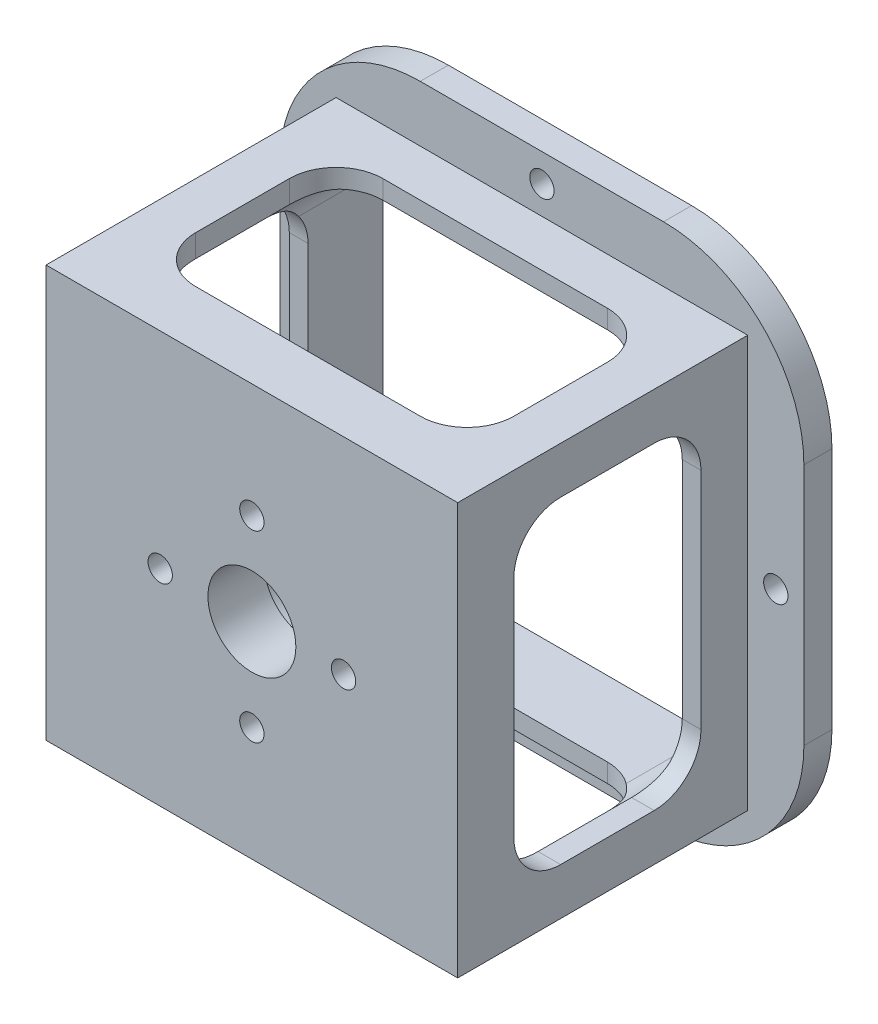
from build123d import *

# Parameters (mm, degrees)
SKETCH1_W           = 71.12
SKETCH1_H           = 71.12
BOSS_EXTRUDE1_DEPTH = 43.18
SKETCH2_W           = 71.12
SKETCH2_H           = 71.12
SKETCH2_W_2         = 55.88
SKETCH2_H_2         = 55.88
CUT_EXTRUDE1_DEPTH  = 39.37
SKETCH4_W           = 50.8
SKETCH4_H           = 50.8
CUT_EXTRUDE2_DEPTH  = 35.56
CUT_EXTRUDE3_REACH  = 111.456
SKETCH5_R           = 1.651
SKETCH5_R_2         = 5.969
CUT_EXTRUDE4_REACH  = 111.456
SKETCH6_R           = 1.651
FILLET1_R           = 6.35
CUT_EXTRUDE5_REACH  = 106.665
CIRPATTERN1_COUNT   = 4
FILLET3_R           = 19.05
SKETCH8_R           = 3.175
CUT_EXTRUDE6_DEPTH  = 3.81


with BuildPart() as part:
    # Sketch1 → Boss-Extrude1 (new body)
    with BuildSketch(Plane.XY):
        with Locations((35.56, 35.56)):
            Rectangle(SKETCH1_W, SKETCH1_H)
    extrude(amount=BOSS_EXTRUDE1_DEPTH)

    # Sketch2 → Cut-Extrude1 (cut)
    with BuildSketch(Plane.XY.offset(43.18)):
        with Locations((35.56, 35.56)):
            Rectangle(SKETCH2_W, SKETCH2_H)
        with Locations((35.56, 35.56)):
            Rectangle(SKETCH2_W_2, SKETCH2_H_2, mode=Mode.SUBTRACT)
    extrude(amount=-CUT_EXTRUDE1_DEPTH, mode=Mode.SUBTRACT)

    # Sketch4 → Cut-Extrude2 (cut)
    with BuildSketch(Plane(origin=(0, 0, 0), x_dir=(-1, 0, 0), z_dir=(0, 0, -1))):
        with Locations((-35.56, 35.56)):
            Rectangle(SKETCH4_W, SKETCH4_H)
    extrude(amount=-CUT_EXTRUDE2_DEPTH, mode=Mode.SUBTRACT)

    # Sketch5 → Cut-Extrude3 (cut, up to next)
    with BuildSketch(Plane.XY.offset(43.18), mode=Mode.PRIVATE) as cut_extrude3_sk1:
        with Locations((35.56, 48.006)):
            Circle(SKETCH5_R)
    cut_extrude3_tool1 = extrude(cut_extrude3_sk1.sketch, amount=-CUT_EXTRUDE3_REACH, mode=Mode.PRIVATE) & part.part
    # Sketch5 → Cut-Extrude3 (cut, up to next)
    with BuildSketch(Plane.XY.offset(43.18), mode=Mode.PRIVATE) as cut_extrude3_sk2:
        with Locations((48.006, 35.56)):
            Circle(SKETCH5_R)
    cut_extrude3_tool2 = extrude(cut_extrude3_sk2.sketch, amount=-CUT_EXTRUDE3_REACH, mode=Mode.PRIVATE) & part.part
    # Sketch5 → Cut-Extrude3 (cut, up to next)
    with BuildSketch(Plane.XY.offset(43.18), mode=Mode.PRIVATE) as cut_extrude3_sk3:
        with Locations((35.56, 23.114)):
            Circle(SKETCH5_R)
    cut_extrude3_tool3 = extrude(cut_extrude3_sk3.sketch, amount=-CUT_EXTRUDE3_REACH, mode=Mode.PRIVATE) & part.part
    # Sketch5 → Cut-Extrude3 (cut, up to next)
    with BuildSketch(Plane.XY.offset(43.18), mode=Mode.PRIVATE) as cut_extrude3_sk4:
        with Locations((23.114, 35.56)):
            Circle(SKETCH5_R)
    cut_extrude3_tool4 = extrude(cut_extrude3_sk4.sketch, amount=-CUT_EXTRUDE3_REACH, mode=Mode.PRIVATE) & part.part
    # Sketch5 → Cut-Extrude3 (cut, up to next)
    with BuildSketch(Plane.XY.offset(43.18), mode=Mode.PRIVATE) as cut_extrude3_sk5:
        with Locations((35.56, 35.56)):
            Circle(SKETCH5_R_2)
    cut_extrude3_tool5 = extrude(cut_extrude3_sk5.sketch, amount=-CUT_EXTRUDE3_REACH, mode=Mode.PRIVATE) & part.part
    add(cut_extrude3_tool1.solids().sort_by_distance((35.56, 48.006, 43.18))[0], mode=Mode.SUBTRACT)
    add(cut_extrude3_tool2.solids().sort_by_distance((48.006, 35.56, 43.18))[0], mode=Mode.SUBTRACT)
    add(cut_extrude3_tool3.solids().sort_by_distance((35.56, 23.114, 43.18))[0], mode=Mode.SUBTRACT)
    add(cut_extrude3_tool4.solids().sort_by_distance((23.114, 35.56, 43.18))[0], mode=Mode.SUBTRACT)
    add(cut_extrude3_tool5.solids().sort_by_distance((35.56, 35.56, 43.18))[0], mode=Mode.SUBTRACT)

    # Sketch6 → Cut-Extrude4 (cut, up to next)
    with BuildSketch(Plane(origin=(0, 0, 0), x_dir=(-1, 0, 0), z_dir=(0, 0, -1)), mode=Mode.PRIVATE) as cut_extrude4_sk1:
        with Locations((-35.56, 67.31)):
            Circle(SKETCH6_R)
    cut_extrude4_tool1 = extrude(cut_extrude4_sk1.sketch, amount=-CUT_EXTRUDE4_REACH, mode=Mode.PRIVATE) & part.part
    # Sketch6 → Cut-Extrude4 (cut, up to next)
    with BuildSketch(Plane(origin=(0, 0, 0), x_dir=(-1, 0, 0), z_dir=(0, 0, -1)), mode=Mode.PRIVATE) as cut_extrude4_sk2:
        with Locations((-3.81, 35.56)):
            Circle(SKETCH6_R)
    cut_extrude4_tool2 = extrude(cut_extrude4_sk2.sketch, amount=-CUT_EXTRUDE4_REACH, mode=Mode.PRIVATE) & part.part
    # Sketch6 → Cut-Extrude4 (cut, up to next)
    with BuildSketch(Plane(origin=(0, 0, 0), x_dir=(-1, 0, 0), z_dir=(0, 0, -1)), mode=Mode.PRIVATE) as cut_extrude4_sk3:
        with Locations((-35.56, 3.81)):
            Circle(SKETCH6_R)
    cut_extrude4_tool3 = extrude(cut_extrude4_sk3.sketch, amount=-CUT_EXTRUDE4_REACH, mode=Mode.PRIVATE) & part.part
    # Sketch6 → Cut-Extrude4 (cut, up to next)
    with BuildSketch(Plane(origin=(0, 0, 0), x_dir=(-1, 0, 0), z_dir=(0, 0, -1)), mode=Mode.PRIVATE) as cut_extrude4_sk4:
        with Locations((-67.31, 35.56)):
            Circle(SKETCH6_R)
    cut_extrude4_tool4 = extrude(cut_extrude4_sk4.sketch, amount=-CUT_EXTRUDE4_REACH, mode=Mode.PRIVATE) & part.part
    add(cut_extrude4_tool1.solids().sort_by_distance((35.56, 67.31, 0))[0], mode=Mode.SUBTRACT)
    add(cut_extrude4_tool2.solids().sort_by_distance((3.81, 35.56, 0))[0], mode=Mode.SUBTRACT)
    add(cut_extrude4_tool3.solids().sort_by_distance((35.56, 3.81, 0))[0], mode=Mode.SUBTRACT)
    add(cut_extrude4_tool4.solids().sort_by_distance((67.31, 35.56, 0))[0], mode=Mode.SUBTRACT)

    # Fillet1
    fillet1_edges = [part.edges().sort_by_distance(p)[0] for p in [
        (60.96, 10.16, 17.78),
        (60.96, 60.96, 17.78),
        (10.16, 60.96, 17.78),
        (10.16, 10.16, 17.78),
    ]]
    fillet(fillet1_edges, radius=FILLET1_R)

    # Sketch7 → Cut-Extrude5 (cut, up to next)
    with BuildSketch(Plane.ZY.offset(-7.62), mode=Mode.PRIVATE) as cut_extrude5_sk1:
        with BuildLine():
            Line((10.16, 20.32), (10.16, 50.8))
            ThreePointArc((10.16, 50.8), (12.019871939, 55.290128061), (16.51, 57.15))
            Line((16.51, 57.15), (29.21, 57.15))
            ThreePointArc((29.21, 57.15), (33.700128061, 55.290128061), (35.56, 50.8))
            Line((35.56, 50.8), (35.56, 20.32))
            ThreePointArc((35.56, 20.32), (33.700128061, 15.829871939), (29.21, 13.97))
            Line((29.21, 13.97), (16.51, 13.97))
            ThreePointArc((16.51, 13.97), (12.019871939, 15.829871939), (10.16, 20.32))
        make_face()
    cut_extrude5_tool1 = extrude(cut_extrude5_sk1.sketch, amount=-CUT_EXTRUDE5_REACH, mode=Mode.PRIVATE) & part.part
    cut_extrude5 = cut_extrude5_tool1.solids().sort_by_distance((7.62, 35.56, 22.86))[0]
    add(cut_extrude5, mode=Mode.SUBTRACT)

    # CirPattern1: Cut-Extrude5 ×4 about axis
    cirpattern1_axis = Axis((35.56, 35.56, 0), (0, 0, 1))
    for i in range(1, CIRPATTERN1_COUNT):
        add(cut_extrude5.rotate(cirpattern1_axis, i * 360 / CIRPATTERN1_COUNT), mode=Mode.SUBTRACT)

    # Fillet3
    fillet3_edges = [part.edges().sort_by_distance(p)[0] for p in [
        (0, 0, 1.905),
        (0, 71.12, 1.905),
        (71.12, 71.12, 1.905),
        (71.12, 0, 1.905),
    ]]
    fillet(fillet3_edges, radius=FILLET3_R)

    # Sketch8 → Cut-Extrude6 (cut)
    with BuildSketch(Plane(origin=(0, 0, 35.56), x_dir=(-1, 0, 0), z_dir=(0, 0, -1))):
        with Locations((-35.56, 48.006)):
            Circle(SKETCH8_R)
        with Locations((-23.114, 35.56)):
            Circle(SKETCH8_R)
        with Locations((-35.56, 23.114)):
            Circle(SKETCH8_R)
        with Locations((-48.006, 35.56)):
            Circle(SKETCH8_R)
    extrude(amount=-CUT_EXTRUDE6_DEPTH, mode=Mode.SUBTRACT)


solid = part.part
